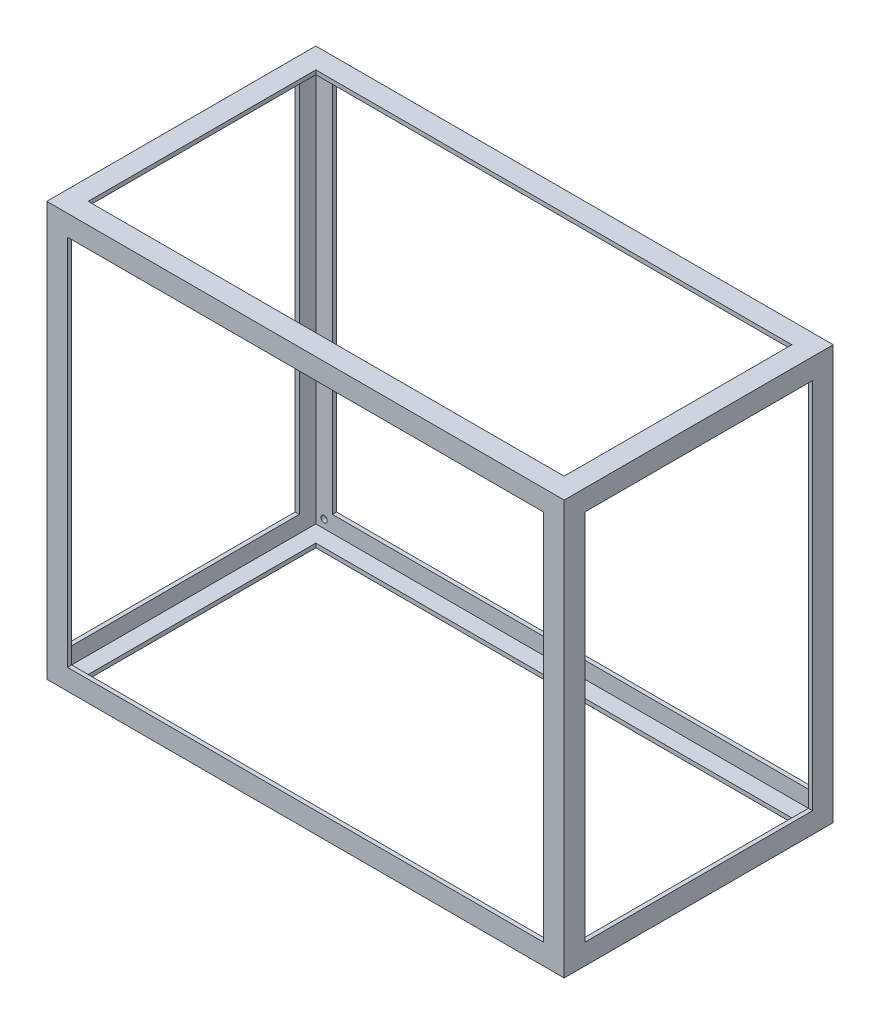
from build123d import *

# Parameters (mm, degrees)
SKETCH1_W           = 250
SKETCH1_H           = 130
BOSS_EXTRUDE1_DEPTH = 200
SKETCH2_W           = 246
SKETCH2_H           = 126
CUT_EXTRUDE1_DEPTH  = 198
SKETCH3_W           = 230
SKETCH3_H           = 180
CUT_EXTRUDE2_DEPTH  = 3
SKETCH4_W           = 250
SKETCH4_H           = 2
BOSS_EXTRUDE2_DEPTH = 10
SKETCH5_W           = 110
SKETCH5_H           = 180
CUT_EXTRUDE3_DEPTH  = 3
SKETCH6_W           = 130
SKETCH6_H           = 2
BOSS_EXTRUDE3_DEPTH = 10
SKETCH7_W           = 230
SKETCH7_H           = 180
CUT_EXTRUDE4_DEPTH  = 3
SKETCH8_W           = 250
SKETCH8_H           = 2
BOSS_EXTRUDE4_DEPTH = 10
SKETCH9_W           = 110
SKETCH9_H           = 180
CUT_EXTRUDE5_DEPTH  = 3
SKETCH10_W          = 130
SKETCH10_H          = 2
BOSS_EXTRUDE5_DEPTH = 10
SKETCH11_W          = 230
SKETCH11_H          = 110
CUT_EXTRUDE7_DEPTH  = 3
SKETCH12_R          = 1.5
CUT_EXTRUDE8_DEPTH  = 3


with BuildPart() as part:
    # Sketch1 → Boss-Extrude1 (new body)
    with BuildSketch(Plane(origin=(0, 0, 0), x_dir=(1, 0, 0), z_dir=(0, 1, 0))):
        Rectangle(SKETCH1_W, SKETCH1_H)
    extrude(amount=BOSS_EXTRUDE1_DEPTH)

    # Sketch2 → Cut-Extrude1 (cut)
    with BuildSketch(Plane(origin=(0, 200, 0), x_dir=(1, 0, 0), z_dir=(0, 1, 0))):
        Rectangle(SKETCH2_W, SKETCH2_H)
    extrude(amount=-CUT_EXTRUDE1_DEPTH, mode=Mode.SUBTRACT)

    # Sketch3 → Cut-Extrude2 (cut)
    with BuildSketch(Plane.XY.offset(65)):
        with Locations((0, 100)):
            Rectangle(SKETCH3_W, SKETCH3_H)
    extrude(amount=-CUT_EXTRUDE2_DEPTH, mode=Mode.SUBTRACT)

    # Sketch4 → Boss-Extrude2 (add)
    with BuildSketch(Plane.XY.offset(65)):
        with Locations((0, 199)):
            Rectangle(SKETCH4_W, SKETCH4_H)
    extrude(amount=-BOSS_EXTRUDE2_DEPTH)

    # Sketch5 → Cut-Extrude3 (cut)
    with BuildSketch(Plane(origin=(125, 0, 0), x_dir=(0, 0, -1), z_dir=(1, 0, 0))):
        with Locations((0, 100)):
            Rectangle(SKETCH5_W, SKETCH5_H)
    extrude(amount=-CUT_EXTRUDE3_DEPTH, mode=Mode.SUBTRACT)

    # Sketch6 → Boss-Extrude3 (add)
    with BuildSketch(Plane(origin=(125, 0, 0), x_dir=(0, 0, -1), z_dir=(1, 0, 0))):
        with Locations((0, 199)):
            Rectangle(SKETCH6_W, SKETCH6_H)
    extrude(amount=-BOSS_EXTRUDE3_DEPTH)

    # Sketch7 → Cut-Extrude4 (cut)
    with BuildSketch(Plane(origin=(0, 0, -65), x_dir=(-1, 0, 0), z_dir=(0, 0, -1))):
        with Locations((0, 100)):
            Rectangle(SKETCH7_W, SKETCH7_H)
    extrude(amount=-CUT_EXTRUDE4_DEPTH, mode=Mode.SUBTRACT)

    # Sketch8 → Boss-Extrude4 (add)
    with BuildSketch(Plane(origin=(0, 0, -65), x_dir=(-1, 0, 0), z_dir=(0, 0, -1))):
        with Locations((0, 199)):
            Rectangle(SKETCH8_W, SKETCH8_H)
    extrude(amount=-BOSS_EXTRUDE4_DEPTH)

    # Sketch9 → Cut-Extrude5 (cut)
    with BuildSketch(Plane.ZY.offset(125)):
        with Locations((0, 100)):
            Rectangle(SKETCH9_W, SKETCH9_H)
    extrude(amount=-CUT_EXTRUDE5_DEPTH, mode=Mode.SUBTRACT)

    # Sketch10 → Boss-Extrude5 (add)
    with BuildSketch(Plane.ZY.offset(125)):
        with Locations((0, 199)):
            Rectangle(SKETCH10_W, SKETCH10_H)
    extrude(amount=-BOSS_EXTRUDE5_DEPTH)

    # Sketch11 → Cut-Extrude7 (cut)
    with BuildSketch(Plane.XZ):
        Rectangle(SKETCH11_W, SKETCH11_H)
    extrude(amount=-CUT_EXTRUDE7_DEPTH, mode=Mode.SUBTRACT)

    # Sketch12 → Cut-Extrude8 (cut)
    with BuildSketch(Plane(origin=(0, 0, -65), x_dir=(-1, 0, 0), z_dir=(0, 0, -1))):
        with Locations((-119, 194)):
            Circle(SKETCH12_R)
        with Locations((119, 194)):
            Circle(SKETCH12_R)
        with Locations((119, 6)):
            Circle(SKETCH12_R)
        with Locations((-119, 6)):
            Circle(SKETCH12_R)
    extrude(amount=-CUT_EXTRUDE8_DEPTH, mode=Mode.SUBTRACT)


solid = part.part
